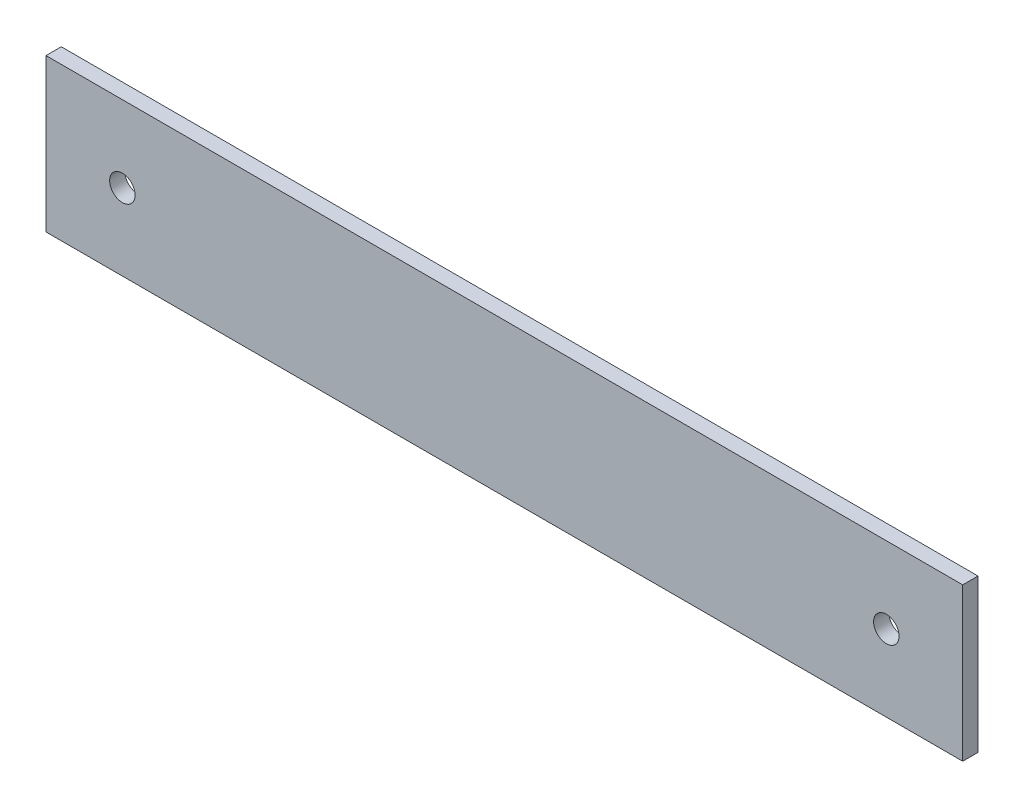
from build123d import *

# Parameters (mm, degrees)
SKETCH1_W           = 180
SKETCH1_H           = 30
SKETCH1_R           = 2.5
BOSS_EXTRUDE1_DEPTH = 3


with BuildPart() as part:
    # Sketch1 → Boss-Extrude1 (new body)
    with BuildSketch(Plane.XY):
        with Locations((90, 15)):
            Rectangle(SKETCH1_W, SKETCH1_H)
        with Locations((15, 15)):
            Circle(SKETCH1_R, mode=Mode.SUBTRACT)
        with Locations((165, 15)):
            Circle(SKETCH1_R, mode=Mode.SUBTRACT)
    extrude(amount=BOSS_EXTRUDE1_DEPTH)


solid = part.part
